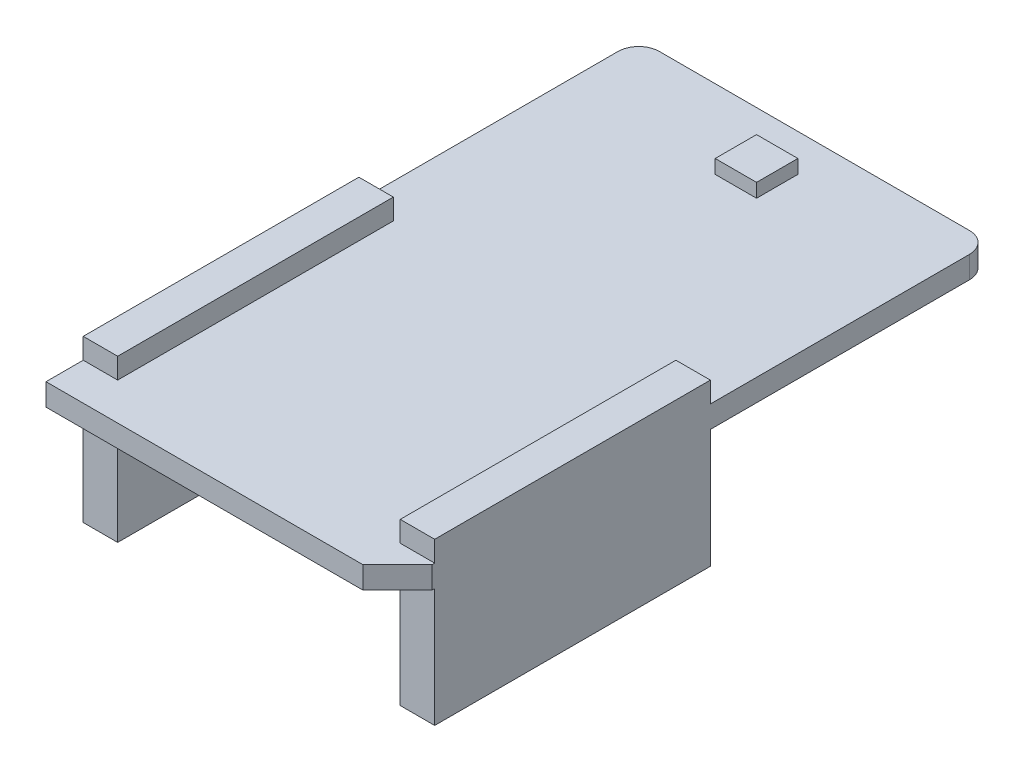
from build123d import *

# Parameters (mm, degrees)
SKETCH1_W                = 25.5
SKETCH1_H                = 43
BOSS_EXTRUDE1_DEPTH      = 1.6
BOSS_EXTRUDE2_DEPTH      = 8.6
BOSS_EXTRUDE2_DEPTH_BACK = 3.1
SKETCH2_W                = 2.5
SKETCH2_H                = 20
SKETCH3_W                = 3
SKETCH3_H                = 3
BOSS_EXTRUDE3_DEPTH      = 1
FILLET1_R                = 1.5
CHAMFER1_SIZE            = 2.5


with BuildPart() as part:
    # Sketch1 → Boss-Extrude1 (new body)
    with BuildSketch(Plane(origin=(0, 0, 0), x_dir=(1, 0, 0), z_dir=(0, 1, 0))):
        with Locations((12.75, 21.5)):
            Rectangle(SKETCH1_W, SKETCH1_H)
    extrude(amount=BOSS_EXTRUDE1_DEPTH)

    # Sketch2 → Boss-Extrude2 (add, two sides: drawn at the far end of the back side and taken through both)
    with BuildSketch(Plane.XZ.offset(-BOSS_EXTRUDE2_DEPTH_BACK)):
        with Locations((1.25, -12.7)):
            Rectangle(SKETCH2_W, SKETCH2_H)
        with Locations((24.25, -12.7)):
            Rectangle(SKETCH2_W, SKETCH2_H)
    extrude(amount=BOSS_EXTRUDE2_DEPTH + BOSS_EXTRUDE2_DEPTH_BACK)

    # Sketch3 → Boss-Extrude3 (add)
    with BuildSketch(Plane(origin=(0, 1.6, 0), x_dir=(1, 0, 0), z_dir=(0, 1, 0))):
        with Locations((12.75, 38.8)):
            Rectangle(SKETCH3_W, SKETCH3_H)
    extrude(amount=BOSS_EXTRUDE3_DEPTH)

    # Fillet1
    fillet1_edges = [part.edges().sort_by_distance(p)[0] for p in [
        (0, 0.8, -43),
        (25.5, 0.8, -43),
    ]]
    fillet(fillet1_edges, radius=FILLET1_R)

    # Chamfer1
    chamfer1_edges = [part.edges().sort_by_distance(p)[0] for p in [
        (25.5, 0.8, 0),
    ]]
    chamfer(chamfer1_edges, length=CHAMFER1_SIZE)


solid = part.part
